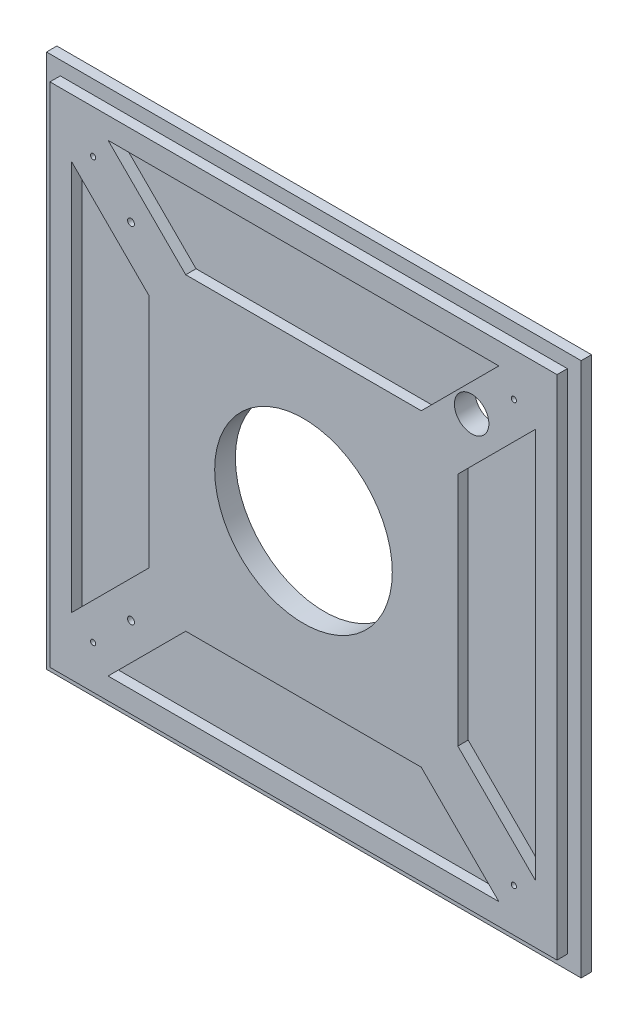
from build123d import *

# Parameters (mm, degrees)
SKETCH1_W               = 310
SKETCH1_H               = 310
BOSS_EXTRUDE1_DEPTH     = 6
BOSS_EXTRUDE2_DEPTH     = 6
SKETCH4_R               = 51.5
CUT_EXTRUDE1_DEPTH      = 439.570404838
SKETCH10_R              = 10
CORNER_CORD_HOLE_DEPTH  = 439.570404838
SKETCH11_R              = 2
CUT_EXTRUDE5_DEPTH      = 439.570404838
SKETCH12_W              = 25
SKETCH12_H              = 10
BOSS_EXTRUDE3_DEPTH     = 6.5
SKETCH13_W              = 25
SKETCH13_H              = 112
BOSS_EXTRUDE4_DEPTH     = 8
CUT_EXTRUDE6_DEPTH      = 440.206386566
CUT_EXTRUDE6_DEPTH_BACK = 440.206386566
SKETCH14_R              = 1.5


with BuildPart() as part:
    # Sketch1 → Boss-Extrude1 (new body)
    with BuildSketch(Plane.XY):
        with Locations((155, -155)):
            Rectangle(SKETCH1_W, SKETCH1_H)
    extrude(amount=BOSS_EXTRUDE1_DEPTH)

    # Sketch3 → Boss-Extrude2 (add)
    with BuildSketch(Plane.XY.offset(6)):
        Polygon((302, -8), (302, -33), (302, -277), (302, -302), (277, -302), (33, -302), (8, -302), (8, -277), (8, -33), (8, -8), (33, -8), (277, -8), align=None)
        Polygon((268.286796564, -20.5), (223.286796564, -65.5), (86.713203436, -65.5), (41.713203436, -20.5), align=None, mode=Mode.SUBTRACT)
        Polygon((20.5, -41.713203436), (65.5, -86.713203436), (65.5, -223.286796564), (20.5, -268.286796564), align=None, mode=Mode.SUBTRACT)
        Polygon((41.713203436, -289.5), (86.713203436, -244.5), (223.286796564, -244.5), (268.286796564, -289.5), align=None, mode=Mode.SUBTRACT)
        Polygon((289.5, -41.713203436), (244.5, -86.713203436), (244.5, -223.286796564), (289.5, -268.286796564), align=None, mode=Mode.SUBTRACT)
    extrude(amount=BOSS_EXTRUDE2_DEPTH)

    # Sketch4 → Cut-Extrude1 (cut, through all)
    with BuildSketch(Plane.XY.offset(12)):
        with Locations((155, -155)):
            Circle(SKETCH4_R)
    extrude(amount=-CUT_EXTRUDE1_DEPTH, mode=Mode.SUBTRACT)

    # Sketch10 → corner cord hole (cut, through all)
    with BuildSketch(Plane(origin=(0, 0, 0), x_dir=(-1, 0, 0), z_dir=(0, 0, -1))):
        with Locations((-252.5, -52.5)):
            Circle(SKETCH10_R)
    extrude(amount=-CORNER_CORD_HOLE_DEPTH, mode=Mode.SUBTRACT)

    # Sketch11 → Cut-Extrude5 (cut, through all)
    with BuildSketch(Plane(origin=(0, 0, 0), x_dir=(-1, 0, 0), z_dir=(0, 0, -1))):
        with Locations((-55, -55)):
            Circle(SKETCH11_R)
        with Locations((-55, -255)):
            Circle(SKETCH11_R)
    extrude(amount=-CUT_EXTRUDE5_DEPTH, mode=Mode.SUBTRACT)

    # Sketch12 → Boss-Extrude3 (add)
    with BuildSketch(Plane(origin=(0, 0, 0), x_dir=(-1, 0, 0), z_dir=(0, 0, -1))):
        with Locations((-272.5, -104)):
            Rectangle(SKETCH12_W, SKETCH12_H)
        with Locations((-272.5, -206)):
            Rectangle(SKETCH12_W, SKETCH12_H)
    extrude(amount=BOSS_EXTRUDE3_DEPTH)

    # Sketch13 → Boss-Extrude4 (add)
    with BuildSketch(Plane(origin=(0, 0, -6.5), x_dir=(-1, 0, 0), z_dir=(0, 0, -1))):
        with Locations((-272.5, -155)):
            Rectangle(SKETCH13_W, SKETCH13_H)
    extrude(amount=BOSS_EXTRUDE4_DEPTH)

    # Sketch14 → Cut-Extrude6 (cut, two sides: drawn at the far end of the back side and taken through both)
    with BuildSketch(Plane.XY.offset(12).offset(-CUT_EXTRUDE6_DEPTH_BACK)):
        with Locations((33, -33)):
            Circle(SKETCH14_R)
        with Locations((277, -33)):
            Circle(SKETCH14_R)
        with Locations((277, -277)):
            Circle(SKETCH14_R)
        with Locations((33, -277)):
            Circle(SKETCH14_R)
    extrude(amount=CUT_EXTRUDE6_DEPTH + CUT_EXTRUDE6_DEPTH_BACK, mode=Mode.SUBTRACT)


solid = part.part
